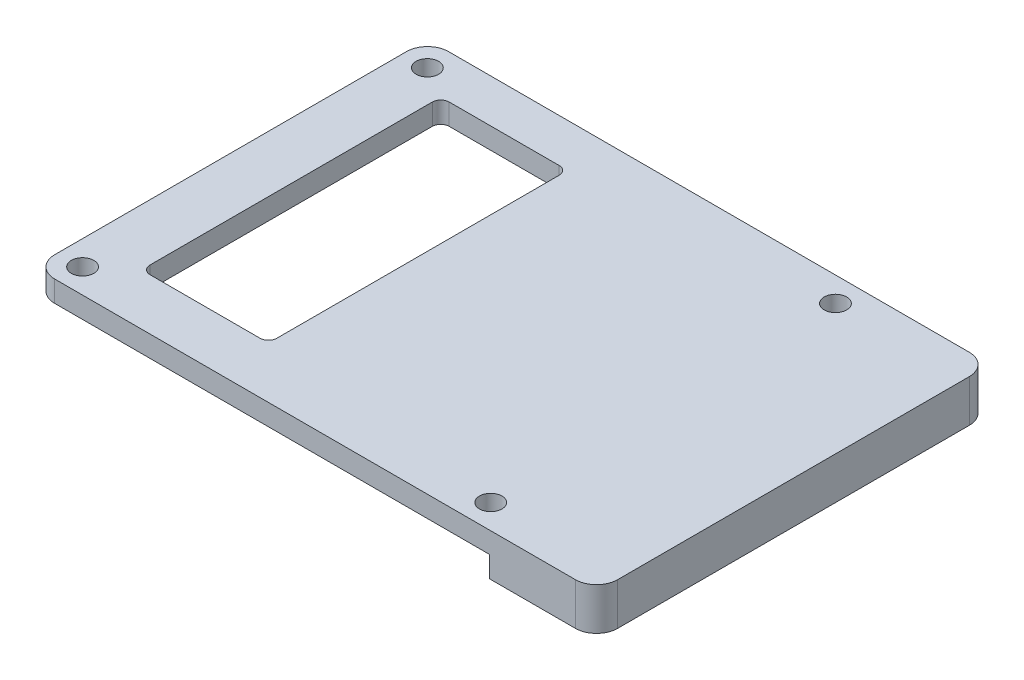
from build123d import *

# Parameters (mm, degrees)
SKETCH_1_R      = 1.6
EXTRUDE_1_DEPTH = 3
EXTRUDE_START   = 3
EXTRUDE_3_DEPTH = 3


with BuildPart() as part:
    # 草图1 → 凸台-拉伸1 (new body)
    with BuildSketch(Plane(origin=(0, 0, 0), x_dir=(1, 0, 0), z_dir=(0, 1, 0))):
        with BuildLine():
            Line((-0.009028181, 21.389975432), (-0.009028181, -28.591736531))
            ThreePointArc((-0.009028181, -28.591736531), (-0.887707838, -30.713056875), (-3.009028181, -31.591736531))
            Line((-3.009028181, -31.591736531), (-77.021723127, -31.591736531))
            ThreePointArc((-77.021723127, -31.591736531), (-79.134066788, -30.716775138), (-80.009028181, -28.604431477))
            Line((-80.009028181, -28.604431477), (-80.009028181, 21.402670377))
            ThreePointArc((-80.009028181, 21.402670377), (-79.134066788, 23.515014039), (-77.021723127, 24.389975432))
            Line((-77.021723127, 24.389975432), (-3.009028181, 24.389975432))
            ThreePointArc((-3.009028181, 24.389975432), (-0.887707838, 23.511295776), (-0.009028181, 21.389975432))
        make_face()
        with Locations(Location((-76.52848462, 20.886724226, 0), (0, 0, 270))):
            Circle(SKETCH_1_R, mode=Mode.SUBTRACT)
        with Locations(Location((-18.52858622, 20.886597225, 0), (0, 0, 270))):
            Circle(SKETCH_1_R, mode=Mode.SUBTRACT)
        with Locations(Location((-18.52833222, -28.113656775, 0), (0, 0, 270))):
            Circle(SKETCH_1_R, mode=Mode.SUBTRACT)
        with Locations(Location((-76.52833222, -28.113529775, 0), (0, 0, 270))):
            Circle(SKETCH_1_R, mode=Mode.SUBTRACT)
        with BuildLine():
            Line((-70.770059731, 18.230282987), (-55.140568984, 18.230282987))
            ThreePointArc((-55.140568984, 18.230282987), (-54.292040846, 17.878811124), (-53.940568984, 17.030282987))
            Line((-53.940568984, 17.030282987), (-53.940568984, -23.088422311))
            ThreePointArc((-53.940568984, -23.088422311), (-54.292040846, -23.936950448), (-55.140568984, -24.288422311))
            Line((-55.140568984, -24.288422311), (-70.770059731, -24.288422311))
            ThreePointArc((-70.770059731, -24.288422311), (-71.618587868, -23.936950448), (-71.970059731, -23.088422311))
            Line((-71.970059731, -23.088422311), (-71.970059731, 17.030282987))
            ThreePointArc((-71.970059731, 17.030282987), (-71.618587868, 17.878811124), (-70.770059731, 18.230282987))
        make_face(mode=Mode.SUBTRACT)
    extrude(amount=EXTRUDE_1_DEPTH)

    # 草图3 → 凸台-拉伸3 (add)
    with BuildSketch(Plane.XZ.offset(EXTRUDE_START)):
        with BuildLine():
            Line((-15.227079657, 31.591736531), (-3.009028181, 31.591736531))
            ThreePointArc((-3.009028181, 31.591736531), (-0.887707838, 30.713056875), (-0.009028181, 28.591736531))
            Line((-0.009028181, 28.591736531), (-0.009028181, -21.389975432))
            ThreePointArc((-0.009028181, -21.389975432), (-0.887707838, -23.511295776), (-3.009028181, -24.389975432))
            Line((-3.009028181, -24.389975432), (-15.227079657, -24.389975432))
            Line((-15.227079657, -24.389975432), (-15.227079657, 31.591736531))
        make_face()
    extrude(amount=-EXTRUDE_3_DEPTH)


solid = part.part
